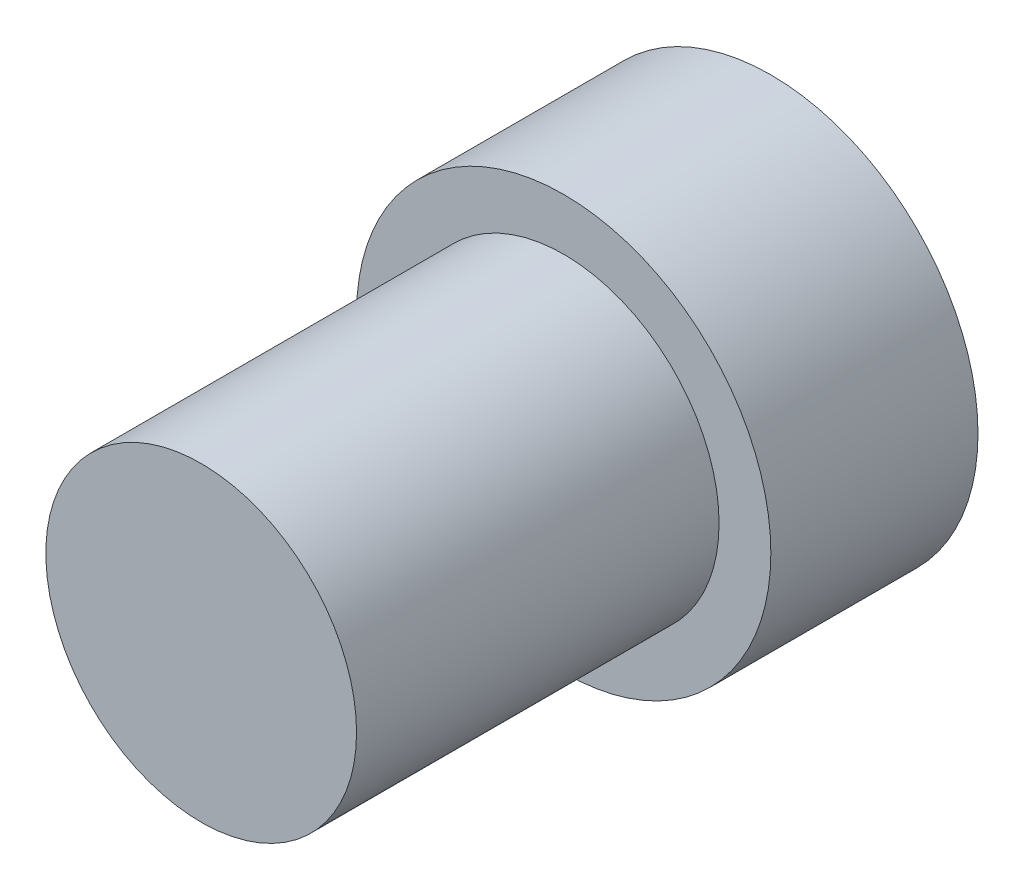
from build123d import *

# Parameters (mm, degrees)
SKETCH1_R           = 4
BOSS_EXTRUDE1_DEPTH = 4
SKETCH3_R           = 3
BOSS_EXTRUDE2_DEPTH = 7


with BuildPart() as part:
    # Sketch1 → Boss-Extrude1 (new body)
    with BuildSketch(Plane.XY):
        Circle(SKETCH1_R)
    extrude(amount=BOSS_EXTRUDE1_DEPTH)

    # Sketch3 → Boss-Extrude2 (add)
    with BuildSketch(Plane.XY.offset(4)):
        Circle(SKETCH3_R)
    extrude(amount=BOSS_EXTRUDE2_DEPTH)


solid = part.part
